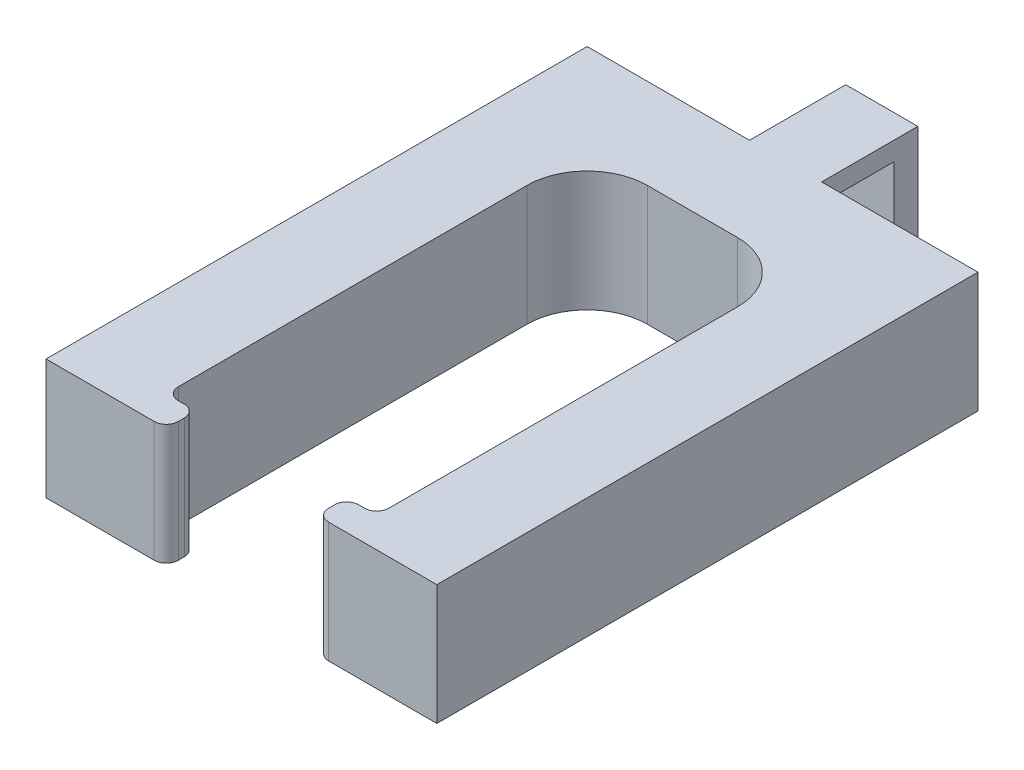
from build123d import *

# Parameters (mm, degrees)
EXTRUDE_1_DEPTH     = 20
EXTRUDE_2_DEPTH     = 64
CUT_EXTRUDE_1_DEPTH = 64


with BuildPart() as part:
    # Эскиз4 → Бобышка-Вытянуть1 (new body)
    with BuildSketch(Plane(origin=(0, 0, 0), x_dir=(1, 0, 0), z_dir=(0, 1, 0))):
        with BuildLine():
            Line((0, 0), (0, 90))
            Line((0, 90), (65, 90))
            Line((65, 90), (65, 0))
            Line((65, 0), (47, 0))
            ThreePointArc((47, 0), (45.585786438, 0.585786438), (45, 2))
            Line((45, 2), (45, 3))
            ThreePointArc((45, 3), (45.585786438, 4.414213562), (47, 5))
            Line((47, 5), (48, 5))
            ThreePointArc((48, 5), (49.414213562, 5.585786438), (50, 7))
            Line((50, 7), (50, 65))
            ThreePointArc((50, 65), (47.071067812, 72.071067812), (40, 75))
            Line((40, 75), (25, 75))
            ThreePointArc((25, 75), (17.928932188, 72.071067812), (15, 65))
            Line((15, 65), (15, 7))
            ThreePointArc((15, 7), (15.585786438, 5.585786438), (17, 5))
            Line((17, 5), (18, 5))
            ThreePointArc((18, 5), (19.414213562, 4.414213562), (20, 3))
            Line((20, 3), (20, 2))
            ThreePointArc((20, 2), (19.414213562, 0.585786438), (18, 0))
            Line((18, 0), (0, 0))
        make_face()
    extrude(amount=EXTRUDE_1_DEPTH)

    # Эскиз6 → Бобышка-Вытянуть2 (add)
    with BuildSketch(Plane(origin=(65, 0, 0), x_dir=(0, 0, -1), z_dir=(1, 0, 0))):
        Polygon((90, 20), (106, 20), (106, -20), (102, -20), (102, 16.898771426), (90, 16.898771426), align=None)
    extrude(amount=-EXTRUDE_2_DEPTH)

    # Эскиз7 → Вырез-Вытянуть1 (cut)
    with BuildSketch(Plane(origin=(0, 20, 0), x_dir=(1, 0, 0), z_dir=(0, 1, 0))):
        Polygon((27, 109.944844375), (27, 90), (-10.963229583, 90), (-10.963229583, 111.789211804), align=None)
        Polygon((39, 90), (39, 113.326184662), (82.188937299, 109.944844375), (82.188937299, 90), align=None)
    extrude(amount=-CUT_EXTRUDE_1_DEPTH, mode=Mode.SUBTRACT)


solid = part.part
